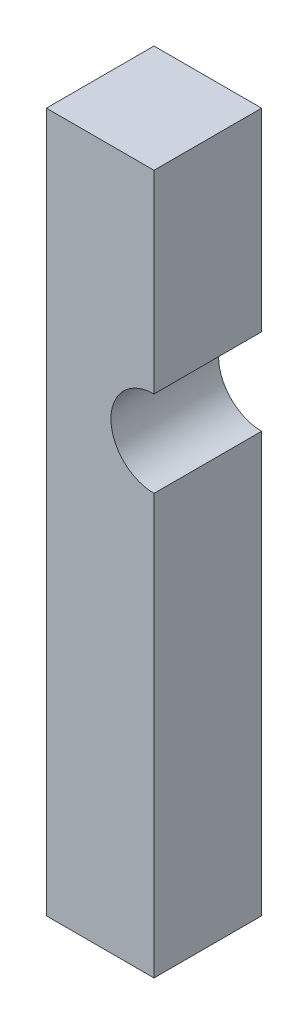
from build123d import *

# Parameters (mm, degrees)
CROQUIS1_W              = 5
CROQUIS1_H              = 5
SALIENTE_EXTRUIR1_DEPTH = 16.25
CROQUIS2_R              = 2
CORTAR_EXTRUIR1_DEPTH   = 18.184658856


with BuildPart() as part:
    # Croquis1 → Saliente-Extruir1 (new, symmetric)
    with BuildSketch(Plane(origin=(0, 0, 0), x_dir=(1, 0, 0), z_dir=(0, 1, 0))):
        Rectangle(CROQUIS1_W, CROQUIS1_H)
    extrude(amount=SALIENTE_EXTRUIR1_DEPTH, both=True)

    # Croquis2 → Cortar-Extruir1 (cut, through all)
    with BuildSketch(Plane.XY.offset(2.5)):
        with Locations((2.5, 5.25)):
            Circle(CROQUIS2_R)
    extrude(amount=-CORTAR_EXTRUIR1_DEPTH, mode=Mode.SUBTRACT)


solid = part.part
